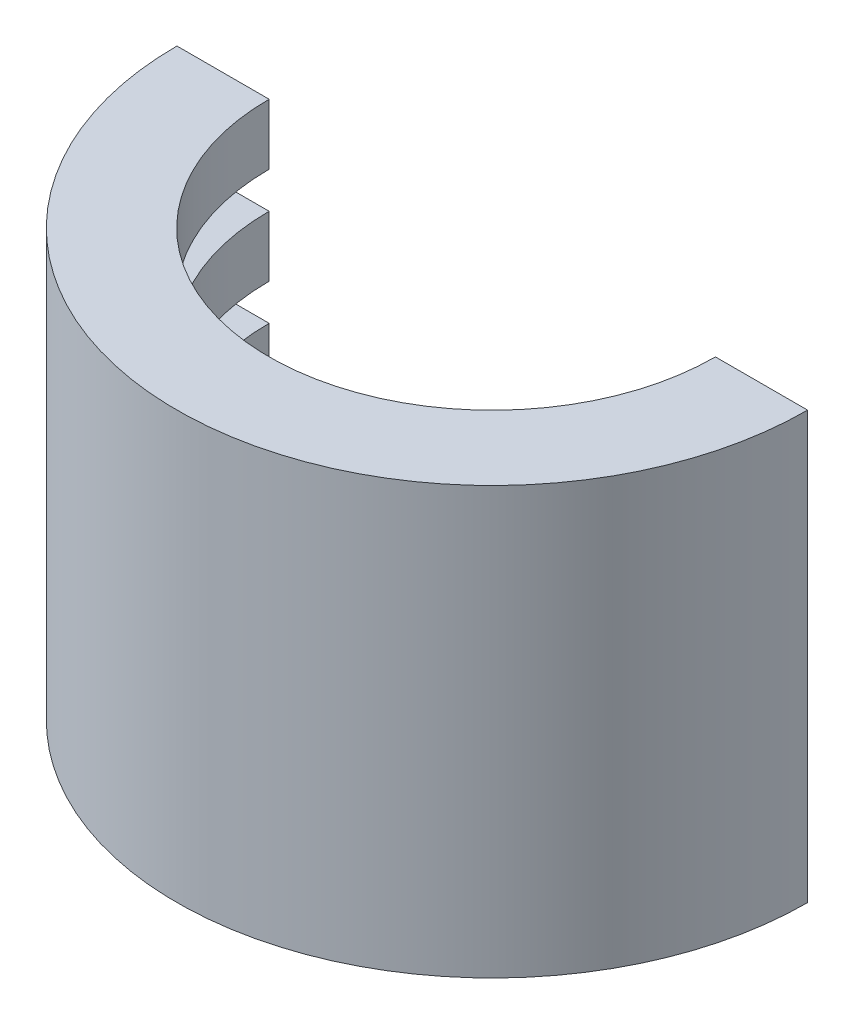
from build123d import *

# Parameters (mm, degrees)
CUT_EXTRUDE_START   = -20
CUT_EXTRUDE_1_DEPTH = 20


with BuildPart() as part:
    # 草图1 → 旋转1 (revolve)
    with BuildSketch(Plane.XY, mode=Mode.PRIVATE) as revolve_1_sk:
        Polygon((0, 2), (1.5, 2), (1.5, 0), (11, 0), (11, 1.5), (9.2, 1.5), (9.2, 4), (11, 4), (11, 5.5), (9.2, 5.5), (9.2, 8), (11, 8), (11, 9.5), (9.2, 9.5), (9.2, 12), (11, 12), (11, 13.5), (9.2, 13.5), (9.2, 16), (13, 16), (13, -1.584568421), (0, -1.584568421), (0, 0), align=None)
    revolve(revolve_1_sk.sketch.rotate(Axis((0, 18, 0), (0, -1, 0)), 180), axis=Axis((0, 18, 0), (0, -1, 0)))

    # 草图2 → 切除-拉伸1 (cut)
    with BuildSketch(Plane(origin=(0, 16, 0), x_dir=(1, 0, 0), z_dir=(0, 1, 0)).offset(CUT_EXTRUDE_START)):
        with BuildLine():
            Line((-13, 0), (13, 0))
            ThreePointArc((13, 0), (0, 13), (-13, 0))
        make_face()
    extrude(amount=CUT_EXTRUDE_1_DEPTH, mode=Mode.SUBTRACT)


solid = part.part
